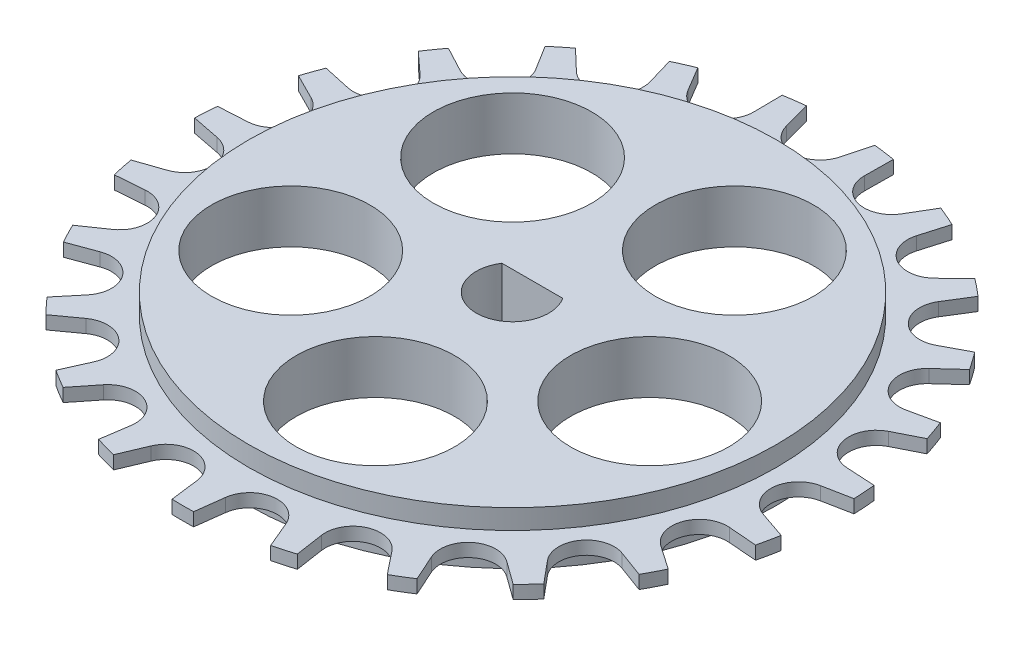
from build123d import *

# Parameters (mm, degrees)
IZIM1_R                     = 50
Y_KSEKLIK_EKSTR_ZYON1_DEPTH = 2
KES_EKSTR_ZYON2_DEPTH       = 2
DAIRESEL_KAPLAMA2_COUNT     = 23
IZIM12_R                    = 40
Y_KSEKLIK_EKSTR_ZYON2_DEPTH = 3
Y_KSEKLIK_EKSTR_ZYON3_START = -3
IZIM13_R                    = 40
Y_KSEKLIK_EKSTR_ZYON3_DEPTH = 3
IZIM14_R                    = 12
KES_EKSTR_ZYON6_DEPTH       = 7
DAIRESEL_KAPLAMA5_COUNT     = 5
KES_EKSTR_ZYON7_DEPTH       = 7


with BuildPart() as part:
    # Çizim1 → Yükseklik-Ekstrüzyon1 (new body)
    with BuildSketch(Plane(origin=(0, 0, 0), x_dir=(1, 0, 0), z_dir=(0, 1, 0))):
        with Locations(Location((0, 0, 0), (0, 0, 270))):
            Circle(IZIM1_R)
    extrude(amount=Y_KSEKLIK_EKSTR_ZYON1_DEPTH)

    # Çizim2 → Kes-Ekstrüzyon2 (cut)
    with BuildSketch(Plane(origin=(0, 2, 0), x_dir=(1, 0, 0), z_dir=(0, 1, 0))):
        with BuildLine():
            Line((-7.668264722, 58.995898097), (5.736778926, 51.800614184))
            Line((5.736778926, 51.800614184), (4.056392608, 45.540740741))
            ThreePointArc((4.056392608, 45.540740741), (0, 42.42962963), (-4.056392608, 45.540740741))
            Line((-4.056392608, 45.540740741), (-7.668264722, 58.995898097))
        make_face()
    kes_ekstr_zyon2 = extrude(amount=-KES_EKSTR_ZYON2_DEPTH, mode=Mode.SUBTRACT)

    # Dairesel Kaplama2: Kes-Ekstrüzyon2 ×23 about axis
    dairesel_kaplama2_axis = Axis((0, 0, 0), (0, 1, 0))
    for i in range(1, DAIRESEL_KAPLAMA2_COUNT):
        add(kes_ekstr_zyon2.rotate(dairesel_kaplama2_axis, i * 360 / DAIRESEL_KAPLAMA2_COUNT), mode=Mode.SUBTRACT)

    # Çizim12 → Yükseklik-Ekstrüzyon2 (add)
    with BuildSketch(Plane(origin=(0, 2, 0), x_dir=(1, 0, 0), z_dir=(0, 1, 0))):
        with Locations(Location((0, 0, 0), (0, 0, 270))):
            Circle(IZIM12_R)
    extrude(amount=Y_KSEKLIK_EKSTR_ZYON2_DEPTH)

    # Çizim13 → Yükseklik-Ekstrüzyon3 (add)
    with BuildSketch(Plane(origin=(0, 0, 0), x_dir=(1, 0, 0), z_dir=(0, 1, 0)).offset(Y_KSEKLIK_EKSTR_ZYON3_START)):
        with Locations(Location((0, 0, 0), (0, 0, 270))):
            Circle(IZIM13_R)
    extrude(amount=Y_KSEKLIK_EKSTR_ZYON3_DEPTH)

    # Çizim14 → Kes-Ekstrüzyon6 (cut, symmetric)
    with BuildSketch(Plane(origin=(0, 2, 0), x_dir=(1, 0, 0), z_dir=(0, 1, 0))):
        with Locations(Location((-17.67766953, 17.67766953, 0), (0, 0, 270))):
            Circle(IZIM14_R)
    kes_ekstr_zyon6 = extrude(amount=KES_EKSTR_ZYON6_DEPTH, both=True, mode=Mode.SUBTRACT)

    # Dairesel Kaplama5: Kes-Ekstrüzyon6 ×5 about axis
    dairesel_kaplama5_axis = Axis((0, 0, 0), (0, 1, 0))
    for i in range(1, DAIRESEL_KAPLAMA5_COUNT):
        add(kes_ekstr_zyon6.rotate(dairesel_kaplama5_axis, i * 360 / DAIRESEL_KAPLAMA5_COUNT), mode=Mode.SUBTRACT)

    # Çizim16 → Kes-Ekstrüzyon7 (cut, symmetric)
    with BuildSketch(Plane(origin=(0, 2, 0), x_dir=(1, 0, 0), z_dir=(0, 1, 0))):
        with BuildLine():
            Line((-4.609772229, 3), (4.609772229, 3))
            ThreePointArc((4.609772229, 3), (0, -5.5), (-4.609772229, 3))
        make_face()
    extrude(amount=KES_EKSTR_ZYON7_DEPTH, both=True, mode=Mode.SUBTRACT)


solid = part.part
